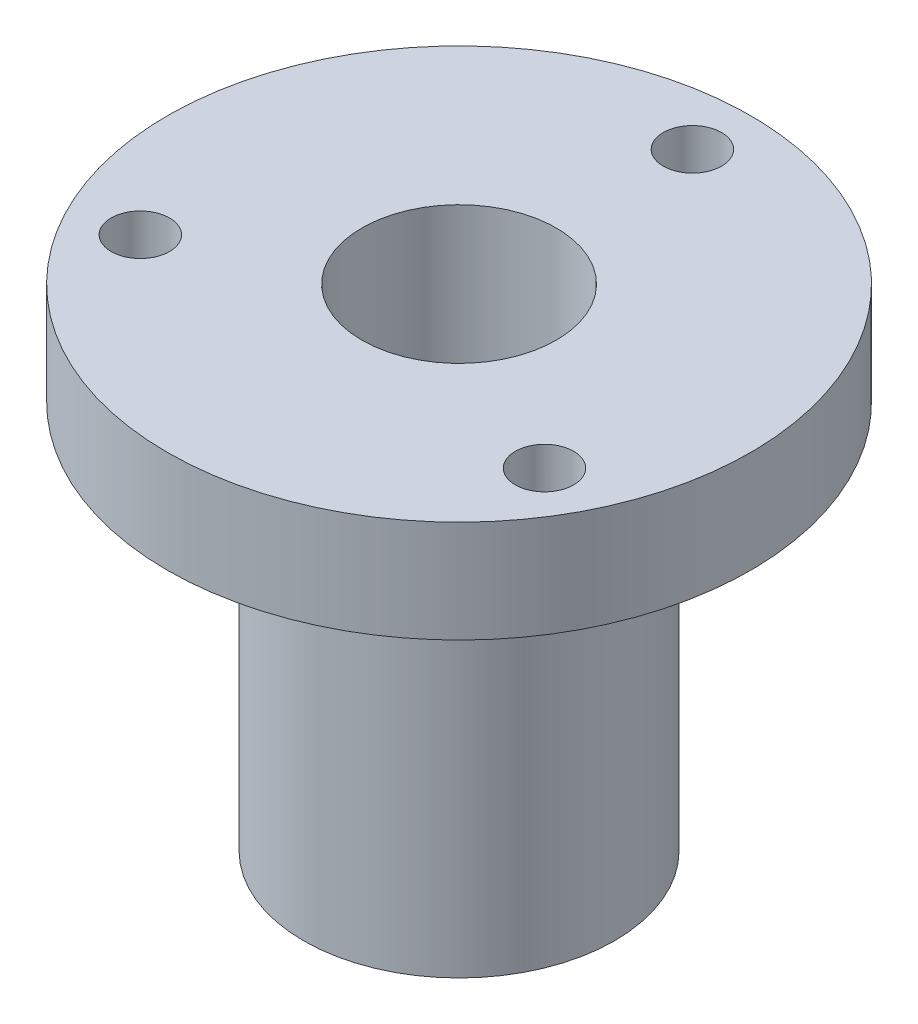
from build123d import *

# Parameters (mm, degrees)
SKETCH2_R          = 1.5
CUT_EXTRUDE1_DEPTH = 10
CIRPATTERN1_COUNT  = 3


with BuildPart() as part:
    # Sketch1 → Revolve1 (revolve)
    with BuildSketch(Plane.XY, mode=Mode.PRIVATE) as revolve1_sk:
        Polygon((-5, 6.826923077), (-5, -18.423076923), (-8, -18.423076923), (-8, 1.576923077), (-15, 1.576923077), (-15, 6.826923077), align=None)
    revolve(revolve1_sk.sketch.rotate(Axis((0, 6, 0), (0, -1, 0)), 270), axis=Axis((0, 6, 0), (0, -1, 0)))

    # Sketch2 → Cut-Extrude1 (cut)
    with BuildSketch(Plane(origin=(0, 6.826923077, 0), x_dir=(1, 0, 0), z_dir=(0, 1, 0))):
        with Locations(Location((0, 12, 0), (0, 0, 270))):
            Circle(SKETCH2_R)
    cut_extrude1 = extrude(amount=-CUT_EXTRUDE1_DEPTH, mode=Mode.SUBTRACT)

    # CirPattern1: Cut-Extrude1 ×3 about axis
    cirpattern1_axis = Axis((0, 0, 0), (0, 1, 0))
    for i in range(1, CIRPATTERN1_COUNT):
        add(cut_extrude1.rotate(cirpattern1_axis, i * 360 / CIRPATTERN1_COUNT), mode=Mode.SUBTRACT)


solid = part.part
